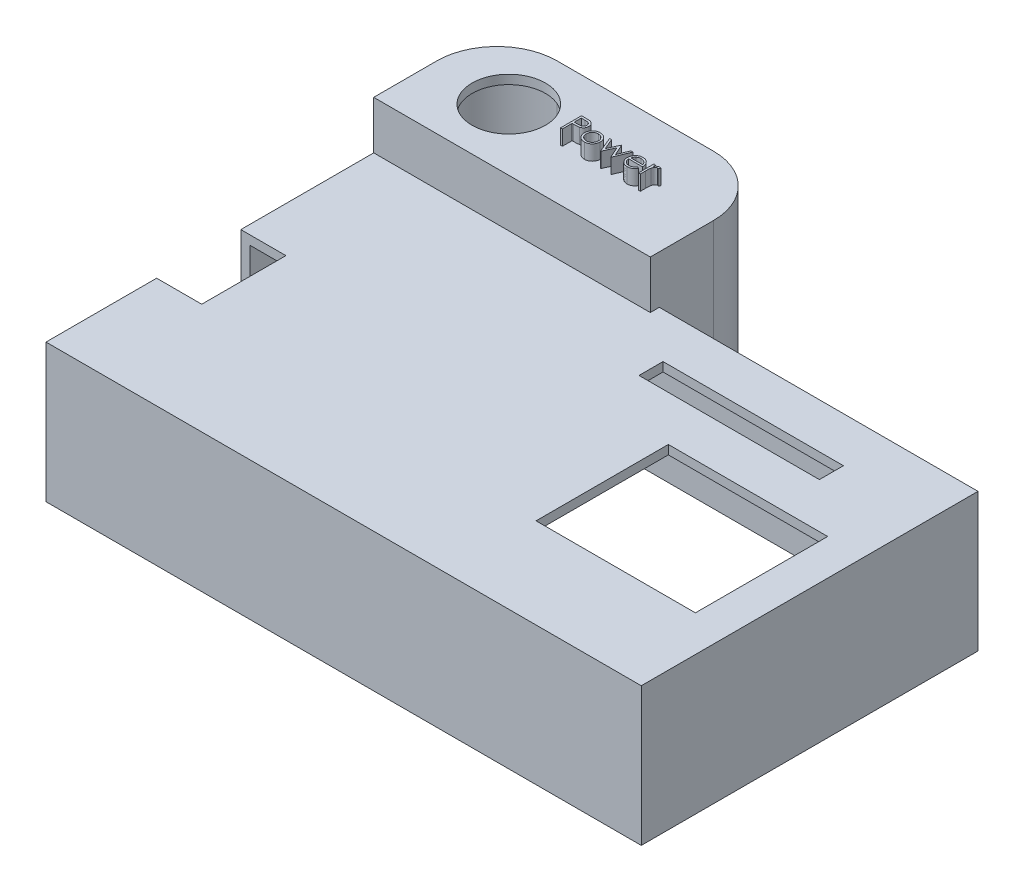
from build123d import *

# Parameters (mm, degrees)
SKETCH1_W           = 99
SKETCH1_H           = 56
BOSS_EXTRUDE1_DEPTH = 23
SKETCH3_W           = 96
SKETCH3_H           = 53
CUT_EXTRUDE1_DEPTH  = 21.5
SKETCH4_W           = 7.5
SKETCH4_H           = 14
CUT_EXTRUDE4_DEPTH  = 11
BOSS_EXTRUDE5_DEPTH = 31
CUT_EXTRUDE8_DEPTH  = 29.5
SKETCH16_W          = 37.752580564
SKETCH16_H          = 16
CUT_EXTRUDE10_DEPTH = 2
SKETCH17_R          = 6.1
CUT_EXTRUDE11_DEPTH = 2
BOSS_EXTRUDE6_DEPTH = 2.5
SKETCH19_W          = 26.5
SKETCH19_H          = 22
CUT_EXTRUDE12_DEPTH = 2
SKETCH20_W          = 30
SKETCH20_H          = 4
CUT_EXTRUDE13_DEPTH = 2


with BuildPart() as part:
    # Sketch1 → Boss-Extrude1 (new body)
    with BuildSketch(Plane(origin=(0, 0, 0), x_dir=(1, 0, 0), z_dir=(0, 1, 0))):
        Rectangle(SKETCH1_W, SKETCH1_H)
    extrude(amount=BOSS_EXTRUDE1_DEPTH)

    # Sketch3 → Cut-Extrude1 (cut)
    with BuildSketch(Plane.XZ):
        Rectangle(SKETCH3_W, SKETCH3_H)
    extrude(amount=-CUT_EXTRUDE1_DEPTH, mode=Mode.SUBTRACT)

    # Sketch4 → Cut-Extrude4 (cut)
    with BuildSketch(Plane(origin=(0, 23, 0), x_dir=(1, 0, 0), z_dir=(0, 1, 0))):
        with Locations((-45.75, -2.6)):
            Rectangle(SKETCH4_W, SKETCH4_H)
    extrude(amount=-CUT_EXTRUDE4_DEPTH, mode=Mode.SUBTRACT)

    # Sketch9 → Boss-Extrude5 (add)
    with BuildSketch(Plane.XZ):
        with BuildLine():
            Line((-3.5, -26.5), (-49.5, -26.5))
            Line((-49.5, -26.5), (-49.5, -37))
            ThreePointArc((-49.5, -37), (-46.571067812, -44.071067812), (-39.5, -47))
            Line((-39.5, -47), (-13.5, -47))
            ThreePointArc((-13.5, -47), (-6.428932188, -44.071067812), (-3.5, -37))
            Line((-3.5, -37), (-3.5, -26.5))
        make_face()
    extrude(amount=-BOSS_EXTRUDE5_DEPTH)

    # Sketch14 → Cut-Extrude8 (cut)
    with BuildSketch(Plane(origin=(0, 0, 0), x_dir=(-1, 0, 0), z_dir=(0, -1, 0))):
        with BuildLine():
            Line((5, 28), (48, 28))
            Line((48, 28), (48, 35.5))
            ThreePointArc((48, 35.5), (45.071067812, 42.571067812), (38, 45.5))
            Line((38, 45.5), (15, 45.5))
            ThreePointArc((15, 45.5), (7.928932188, 42.571067812), (5, 35.5))
            Line((5, 35.5), (5, 28))
        make_face()
    extrude(amount=-CUT_EXTRUDE8_DEPTH, mode=Mode.SUBTRACT)

    # Sketch16 → Cut-Extrude10 (cut)
    with BuildSketch(Plane.XY.offset(-26.5)):
        with Locations((-27.111178413, 12)):
            Rectangle(SKETCH16_W, SKETCH16_H)
    extrude(amount=-CUT_EXTRUDE10_DEPTH, mode=Mode.SUBTRACT)

    # Sketch17 → Cut-Extrude11 (cut)
    with BuildSketch(Plane(origin=(0, 29.5, 0), x_dir=(-1, 0, 0), z_dir=(0, -1, 0))):
        with Locations(Location((37.281553398, 36.75, 0), (0, 0, 90))):
            Circle(SKETCH17_R)
    extrude(amount=-CUT_EXTRUDE11_DEPTH, mode=Mode.SUBTRACT)

    # Sketch18 → Boss-Extrude6 (add)
    # profile 1 of 5: a face of its own
    with BuildSketch(Plane(origin=(0, 31, 0), x_dir=(1, 0, 0), z_dir=(0, 1, 0))):
        with BuildLine():
            Line((-27.068619083, 38.631067961), (-26.382220846, 38.631067961))
            add(Edge.make_bspline(
                [(-26.382220846, 38.631067961), (-26.33500994, 38.631016065), (-26.244551747, 38.630916629), (-26.114836691, 38.627901884), (-25.99702696, 38.623875192), (-25.891376579, 38.618293298), (-25.797560481, 38.611696708), (-25.716003181, 38.602444669), (-25.646063625, 38.592784373), (-25.604157175, 38.582962967), (-25.585045365, 38.578483827)],
                knots=[0, 0, 0, 0, 1.415646017, 2.712440637, 3.8905458, 4.950247383, 5.884950622, 6.709939814, 7.411656543, 8, 8, 8, 8], degree=3))
            add(Edge.make_bspline(
                [(-25.585045365, 38.578483827), (-25.560851831, 38.571861877), (-25.513034854, 38.558774015), (-25.444133811, 38.532560292), (-25.378579966, 38.501478126), (-25.316148407, 38.466054187), (-25.257606324, 38.424768622), (-25.202080283, 38.379295005), (-25.150060303, 38.328583436), (-25.101838911, 38.273202696), (-25.057554113, 38.214082486), (-25.019424431, 38.150340256), (-24.987497204, 38.083048953), (-24.960113932, 38.012255382), (-24.940405478, 37.937365058), (-24.925558578, 37.858898346), (-24.91613495, 37.776863656), (-24.915232389, 37.720803788), (-24.914772929, 37.692265878)],
                knots=[0, 0, 0, 0, 0.999701418, 1.975846123, 2.934577507, 3.890451536, 4.834027766, 5.787354733, 6.749476667, 7.726910423, 8.712836071, 9.690891519, 10.682875813, 11.679750201, 12.712814741, 13.765529915, 14.8625177, 16, 16, 16, 16], degree=3))
            add(Edge.make_bspline(
                [(-24.914772929, 37.692265878), (-24.915194354, 37.663488101), (-24.9160189, 37.607182437), (-24.925915185, 37.524809649), (-24.939245377, 37.446091259), (-24.959742429, 37.371201808), (-24.986588102, 37.300586038), (-25.018080155, 37.233164806), (-25.056063686, 37.170085134), (-25.099708515, 37.111118016), (-25.14826011, 37.056208104), (-25.201513048, 37.00575331), (-25.25925234, 36.960048971), (-25.321294488, 36.918992627), (-25.388244337, 36.883536348), (-25.459086491, 36.851779043), (-25.534436707, 36.825107982), (-25.586579221, 36.811077921), (-25.613090237, 36.803944564)],
                knots=[0, 0, 0, 0, 1.121902311, 2.195077645, 3.232258892, 4.234102512, 5.217864754, 6.176164875, 7.132989551, 8.084763148, 9.034132444, 9.988522005, 10.94243251, 11.903244335, 12.886203696, 13.894208494, 14.929344452, 16, 16, 16, 16], degree=3))
            add(Edge.make_bspline(
                [(-25.613090237, 36.803944564), (-25.635017571, 36.799281583), (-25.683072598, 36.789062388), (-25.762215321, 36.777653932), (-25.854360706, 36.767916331), (-25.959382986, 36.760615193), (-26.077187891, 36.754364825), (-26.207839149, 36.749396731), (-26.351593226, 36.746666877), (-26.45186447, 36.746526084), (-26.504216038, 36.746452577)],
                knots=[0, 0, 0, 0, 0.601384939, 1.31797006, 2.144135048, 3.087295005, 4.142315834, 5.309527816, 6.595305764, 8, 8, 8, 8], degree=3))
            Line((-26.504216038, 36.746452577), (-26.754516519, 36.746452577))
            Line((-26.754516519, 36.746452577), (-26.754516519, 35.131067961))
            Line((-26.754516519, 35.131067961), (-27.068619083, 35.131067961))
            Line((-27.068619083, 35.131067961), (-27.068619083, 38.631067961))
        make_face()
        with BuildLine():
            Line((-26.754516519, 38.272093602), (-26.754516519, 37.105426936))
            Line((-26.754516519, 37.105426936), (-26.14173607, 37.097714596))
            add(Edge.make_bspline(
                [(-26.14173607, 37.097714596), (-26.111816145, 37.097699132), (-26.054056345, 37.09766928), (-25.970620121, 37.101654504), (-25.893210834, 37.106255036), (-25.822066259, 37.11299096), (-25.757154324, 37.122512217), (-25.698366795, 37.132123955), (-25.646159512, 37.146029318), (-25.585060311, 37.164752387), (-25.516976963, 37.196685002), (-25.442909415, 37.243034893), (-25.380138828, 37.302115601), (-25.325820532, 37.368543432), (-25.282714654, 37.442442561), (-25.251158661, 37.521511498), (-25.232617504, 37.604939348), (-25.23013131, 37.662027487), (-25.228875493, 37.690863634)],
                knots=[0, 0, 0, 0, 1.160613943, 2.240541288, 3.23993089, 4.169200891, 5.011653406, 5.7853311, 6.478053781, 7.106038997, 8.262395093, 9.384106736, 10.481365981, 11.59014053, 12.70357646, 13.786202915, 14.881775077, 16, 16, 16, 16], degree=3))
            add(Edge.make_bspline(
                [(-25.228875493, 37.690863634), (-25.23013814, 37.719002148), (-25.232648125, 37.77493803), (-25.251303988, 37.85691679), (-25.282653302, 37.935152495), (-25.326109896, 38.00812558), (-25.378851026, 38.074314384), (-25.44015037, 38.131811511), (-25.509863631, 38.178033214), (-25.574711862, 38.207866496), (-25.632313048, 38.226081771), (-25.682345008, 38.238826611), (-25.738835682, 38.249002218), (-25.801803462, 38.257241721), (-25.870760296, 38.264295182), (-25.946298611, 38.269081159), (-26.028132254, 38.271882615), (-26.084942825, 38.27202157), (-26.11439232, 38.272093602)],
                knots=[0, 0, 0, 0, 1.120700087, 2.227813068, 3.331159281, 4.466773991, 5.599788987, 6.693661531, 7.80175334, 8.91857717, 9.525282508, 10.207424825, 10.974604443, 11.810962634, 12.737642355, 13.736264703, 14.826523623, 16, 16, 16, 16], degree=3))
            Line((-26.11439232, 38.272093602), (-26.754516519, 38.272093602))
        make_face(mode=Mode.SUBTRACT)
    # profile 2 of 5: a face of its own
    with BuildSketch(Plane(origin=(0, 31, 0), x_dir=(1, 0, 0), z_dir=(0, 1, 0))):
        with BuildLine():
            add(Edge.make_bspline(
                [(-23.051191199, 37.733632064), (-23.003199926, 37.732610173), (-22.909100768, 37.730606494), (-22.771292882, 37.709191528), (-22.639747746, 37.676444164), (-22.513961554, 37.631172602), (-22.395545259, 37.570490651), (-22.282774015, 37.49808136), (-22.175957006, 37.412298766), (-22.111933976, 37.345940698), (-22.079436391, 37.312257865)],
                knots=[0, 0, 0, 0, 1.054011418, 2.066658804, 3.057071809, 4.030435133, 4.997543892, 5.974964718, 6.972108034, 8, 8, 8, 8], degree=3))
            add(Edge.make_bspline(
                [(-22.079436391, 37.312257865), (-22.051454437, 37.280043879), (-21.996032057, 37.216239337), (-21.924966338, 37.112783724), (-21.863744778, 37.005643623), (-21.814681817, 36.893396297), (-21.775996793, 36.777021626), (-21.748531097, 36.656119614), (-21.732194162, 36.530957267), (-21.729991195, 36.445953429), (-21.728875493, 36.402902897)],
                knots=[0, 0, 0, 0, 1.025258237, 2.030674902, 3.01204498, 3.988269485, 4.97094183, 5.956517959, 6.965070386, 8, 8, 8, 8], degree=3))
            add(Edge.make_bspline(
                [(-21.728875493, 36.402902897), (-21.729856831, 36.359602839), (-21.731795999, 36.274039906), (-21.750139615, 36.14802054), (-21.778670701, 36.025825718), (-21.81950254, 35.907967024), (-21.871860649, 35.794084196), (-21.935751336, 35.684674647), (-22.011622953, 35.579522514), (-22.09762695, 35.479520676), (-22.192678826, 35.387354461), (-22.295794975, 35.307026191), (-22.404949008, 35.238204667), (-22.521592362, 35.182768251), (-22.644659849, 35.139058551), (-22.774416917, 35.108358535), (-22.910661987, 35.089796851), (-23.003689208, 35.087413278), (-23.051191199, 35.086196166)],
                knots=[0, 0, 0, 0, 0.998656419, 1.973391657, 2.932242238, 3.890759089, 4.846373663, 5.82037756, 6.809684879, 7.83454468, 8.860553229, 9.859544525, 10.845671541, 11.83227036, 12.833544569, 13.85385346, 14.904124723, 16, 16, 16, 16], degree=3))
            add(Edge.make_bspline(
                [(-23.051191199, 35.086196166), (-23.098925918, 35.087417363), (-23.192416778, 35.089809137), (-23.32914276, 35.10828642), (-23.459132379, 35.139044402), (-23.582360977, 35.182911895), (-23.699505824, 35.238206439), (-23.809292321, 35.306818128), (-23.912492237, 35.387378284), (-24.007564221, 35.479514221), (-24.093562826, 35.579524177), (-24.169435835, 35.684674215), (-24.233326161, 35.794084309), (-24.285684365, 35.907966994), (-24.326516178, 36.025825726), (-24.35504727, 36.148020538), (-24.373390885, 36.274039907), (-24.375330053, 36.35960284), (-24.376311391, 36.402902897)],
                knots=[0, 0, 0, 0, 1.099876186, 2.154163076, 3.173186993, 4.173200201, 5.163417411, 6.152872554, 7.150605724, 8.17532212, 9.198891216, 10.186952605, 11.159729845, 12.11414092, 13.071450619, 14.029093627, 15.002601286, 16, 16, 16, 16], degree=3))
            add(Edge.make_bspline(
                [(-24.376311391, 36.402902897), (-24.375188081, 36.445719443), (-24.372964119, 36.530488845), (-24.35664361, 36.655415906), (-24.329285054, 36.776113295), (-24.290553657, 36.892038771), (-24.241038466, 37.003794207), (-24.180677178, 37.111199038), (-24.108886546, 37.214186839), (-24.053684594, 37.277908919), (-24.025750493, 37.3101545)],
                knots=[0, 0, 0, 0, 1.031353054, 2.041901799, 3.029428768, 4.008703097, 4.981709435, 5.96992636, 6.972712378, 8, 8, 8, 8], degree=3))
            add(Edge.make_bspline(
                [(-24.025750493, 37.3101545), (-23.993301902, 37.344129439), (-23.929486039, 37.410947135), (-23.822137311, 37.496479659), (-23.70964349, 37.570395733), (-23.589918564, 37.629871948), (-23.464235706, 37.676710466), (-23.332016463, 37.709275981), (-23.193740948, 37.730529336), (-23.099181327, 37.732587514), (-23.051191199, 37.733632064)],
                knots=[0, 0, 0, 0, 1.027980169, 2.021703884, 2.998553061, 3.971491411, 4.943284454, 5.930300938, 6.949603206, 8, 8, 8, 8], degree=3))
        make_face()
        with BuildLine():
            add(Edge.make_bspline(
                [(-23.052593442, 37.4195295), (-23.086531053, 37.418564908), (-23.153530182, 37.416660625), (-23.252149767, 37.402176721), (-23.347089921, 37.379229217), (-23.438530765, 37.34662516), (-23.526163937, 37.304526261), (-23.61007334, 37.252817901), (-23.69050578, 37.192184945), (-23.765887843, 37.122722273), (-23.835070155, 37.046843279), (-23.895548132, 36.96599492), (-23.946973238, 36.881488573), (-23.989813397, 36.793236362), (-24.021720585, 36.700343948), (-24.044893608, 36.603863317), (-24.059363848, 36.503597901), (-24.061250227, 36.435436882), (-24.062208827, 36.400799532)],
                knots=[0, 0, 0, 0, 1.021534396, 2.016698045, 2.994645724, 3.958388632, 4.93408049, 5.916473867, 6.921342795, 7.962252576, 8.998418191, 10.008913653, 10.997312074, 11.973003931, 12.956656626, 13.948281152, 14.957379055, 16, 16, 16, 16], degree=3))
            add(Edge.make_bspline(
                [(-24.062208827, 36.400799532), (-24.060602003, 36.356047505), (-24.057412759, 36.267223099), (-24.031477522, 36.136411976), (-23.988091242, 36.010830124), (-23.929503963, 35.891213738), (-23.856097744, 35.78054146), (-23.769610677, 35.681869976), (-23.670970977, 35.596684164), (-23.561354477, 35.526003319), (-23.443000159, 35.469843563), (-23.317743838, 35.430044587), (-23.187103144, 35.404172895), (-23.097822413, 35.401601421), (-23.052593442, 35.40029873)],
                knots=[0, 0, 0, 0, 1.016792936, 2.018143844, 3.017858371, 4.030088057, 5.03801393, 6.028138512, 7.003788237, 7.991172063, 8.984598303, 9.972568034, 10.972917682, 12, 12, 12, 12], degree=3))
            add(Edge.make_bspline(
                [(-23.052593442, 35.40029873), (-23.007367073, 35.401609011), (-22.918091477, 35.404195468), (-22.7876323, 35.429914287), (-22.662718329, 35.470017948), (-22.544486941, 35.525940158), (-22.434920338, 35.596952573), (-22.335571216, 35.68138895), (-22.249822605, 35.780802801), (-22.176489, 35.89136033), (-22.116942258, 36.010644682), (-22.073759056, 36.136435154), (-22.04776147, 36.267217196), (-22.044580641, 36.356045527), (-22.042978058, 36.400799532)],
                knots=[0, 0, 0, 0, 1.02726834, 2.027799167, 3.010890988, 4.004497153, 4.992059811, 5.971914811, 6.958719428, 7.966827853, 8.981595046, 9.981490638, 10.983022906, 12, 12, 12, 12], degree=3))
            add(Edge.make_bspline(
                [(-22.042978058, 36.400799532), (-22.043936328, 36.435437089), (-22.045822057, 36.503598515), (-22.060297021, 36.603860969), (-22.083452561, 36.700352565), (-22.115424178, 36.793204569), (-22.158078192, 36.881717073), (-22.210494985, 36.9657468), (-22.27072601, 37.047123346), (-22.340743131, 37.122476987), (-22.416046509, 37.192212023), (-22.496511547, 37.252841413), (-22.580296526, 37.304299008), (-22.667675109, 37.346985249), (-22.759127676, 37.378932589), (-22.853934805, 37.402309221), (-22.952133615, 37.416599417), (-23.018892658, 37.418546559), (-23.052593442, 37.4195295)],
                knots=[0, 0, 0, 0, 1.042956736, 2.052379634, 3.044323526, 4.02829302, 5.004299113, 5.996692471, 7.007513377, 8.048758398, 9.090003419, 10.095195979, 11.07790575, 12.047570684, 13.018257071, 13.989683339, 14.985167495, 16, 16, 16, 16], degree=3))
        make_face(mode=Mode.SUBTRACT)
    # profile 3 of 5: a face of its own
    with BuildSketch(Plane(origin=(0, 31, 0), x_dir=(1, 0, 0), z_dir=(0, 1, 0))):
        Polygon((-21.459644724, 37.688760269), (-21.123106263, 37.688760269), (-20.36028575, 35.849016679), (-19.526651936, 37.688760269), (-19.472665558, 37.688760269), (-18.655157545, 35.849016679), (-17.886026936, 37.688760269), (-17.55579857, 37.688760269), (-18.625009308, 35.131067961), (-18.689512513, 35.131067961), (-19.507721647, 36.970811551), (-20.341355461, 35.131067961), (-20.398847449, 35.131067961), align=None)
    # profile 4 of 5: a face of its own
    with BuildSketch(Plane(origin=(0, 31, 0), x_dir=(1, 0, 0), z_dir=(0, 1, 0))):
        with BuildLine():
            Line((-15.052793763, 35.938760269), (-14.773747288, 35.792225814))
            add(Edge.make_bspline(
                [(-14.773747288, 35.792225814), (-14.795983884, 35.752782482), (-14.839247492, 35.67604138), (-14.91364824, 35.570609519), (-14.991640313, 35.475761803), (-15.076744281, 35.394032149), (-15.166413959, 35.322780764), (-15.261146614, 35.260442939), (-15.361435432, 35.207324419), (-15.467285157, 35.162571891), (-15.579584708, 35.128162397), (-15.698606224, 35.103858176), (-15.82457772, 35.088834907), (-15.9109239, 35.087089767), (-15.955137513, 35.086196166)],
                knots=[0, 0, 0, 0, 1.120438281, 2.179929193, 3.190490725, 4.156257408, 5.095198341, 6.022838206, 6.959905092, 7.901321166, 8.864066838, 9.862729781, 10.905609505, 12, 12, 12, 12], degree=3))
            add(Edge.make_bspline(
                [(-15.955137513, 35.086196166), (-16.00427949, 35.087343342), (-16.100141252, 35.089581148), (-16.239680999, 35.108873613), (-16.371060417, 35.140345971), (-16.494272121, 35.184311513), (-16.609014373, 35.241738837), (-16.715515228, 35.311698319), (-16.814334754, 35.393830574), (-16.902358963, 35.488847017), (-16.981602846, 35.590528974), (-17.051528666, 35.696484859), (-17.109986097, 35.806448083), (-17.157538707, 35.919718607), (-17.195943572, 36.035582501), (-17.222710276, 36.155093968), (-17.238140024, 36.277929553), (-17.240504469, 36.361026888), (-17.241696006, 36.402902897)],
                knots=[0, 0, 0, 0, 1.145258523, 2.234067595, 3.276747158, 4.290159414, 5.277019952, 6.260822364, 7.254936242, 8.264827045, 9.274100331, 10.257902744, 11.220704747, 12.172965371, 13.118907548, 14.062713208, 15.023725156, 16, 16, 16, 16], degree=3))
            add(Edge.make_bspline(
                [(-17.241696006, 36.402902897), (-17.240636865, 36.442197727), (-17.238537787, 36.520074892), (-17.225306999, 36.635340437), (-17.201858706, 36.747368889), (-17.169682382, 36.856253337), (-17.128131136, 36.961811471), (-17.077298917, 37.064107535), (-17.017106539, 37.163032675), (-16.970633865, 37.225435808), (-16.947224852, 37.256869243)],
                knots=[0, 0, 0, 0, 1.024358464, 2.0301432, 3.019427413, 4.004406732, 4.986367066, 5.972626655, 6.978780325, 8, 8, 8, 8], degree=3))
            add(Edge.make_bspline(
                [(-16.947224852, 37.256869243), (-16.91551717, 37.294738113), (-16.853106223, 37.369276264), (-16.747549868, 37.46721459), (-16.633249671, 37.549258365), (-16.511638045, 37.617265501), (-16.381301571, 37.668939148), (-16.24399228, 37.70744673), (-16.098146694, 37.729024741), (-15.998441473, 37.732072575), (-15.947425173, 37.733632064)],
                knots=[0, 0, 0, 0, 1.030682036, 2.02871468, 2.997146059, 3.962720338, 4.930598197, 5.918074684, 6.934738563, 8, 8, 8, 8], degree=3))
            add(Edge.make_bspline(
                [(-15.947425173, 37.733632064), (-15.894977568, 37.732278015), (-15.792087322, 37.72962168), (-15.642055201, 37.704995346), (-15.500094484, 37.665942792), (-15.36626198, 37.610789001), (-15.240544119, 37.539629449), (-15.123758069, 37.451487608), (-15.013906557, 37.349069521), (-14.949997978, 37.270306311), (-14.917477256, 37.230226615)],
                knots=[0, 0, 0, 0, 1.056321875, 2.072262726, 3.055038591, 4.01806755, 4.982017516, 5.957941055, 6.960871419, 8, 8, 8, 8], degree=3))
            add(Edge.make_bspline(
                [(-14.917477256, 37.230226615), (-14.895350318, 37.200023034), (-14.851243725, 37.139816915), (-14.795996625, 37.041645758), (-14.74803923, 36.938935163), (-14.709706269, 36.830024866), (-14.678666768, 36.716205286), (-14.656209949, 36.596662742), (-14.64304033, 36.47143283), (-14.640451633, 36.386106275), (-14.639131904, 36.342606423)],
                knots=[0, 0, 0, 0, 0.94817472, 1.890038105, 2.849395472, 3.817997239, 4.812318967, 5.836947057, 6.897266129, 8, 8, 8, 8], degree=3))
            Line((-14.639131904, 36.342606423), (-16.927593442, 36.342606423))
            add(Edge.make_bspline(
                [(-16.927593442, 36.342606423), (-16.926053836, 36.308905958), (-16.923026262, 36.242635355), (-16.908911119, 36.145664572), (-16.886662345, 36.053291229), (-16.855393282, 35.966208187), (-16.817526437, 35.88327806), (-16.77114072, 35.805116023), (-16.715801166, 35.732078093), (-16.654075467, 35.663510955), (-16.585368371, 35.602450194), (-16.513085624, 35.547798418), (-16.436192059, 35.501992821), (-16.355293976, 35.464812931), (-16.270522191, 35.435706615), (-16.181849996, 35.415838795), (-16.089451879, 35.402531688), (-16.026466145, 35.401052023), (-15.994400333, 35.40029873)],
                knots=[0, 0, 0, 0, 1.094153842, 2.151609401, 3.174256925, 4.172055639, 5.149267565, 6.128595816, 7.11444997, 8.118368179, 9.117203808, 10.09244225, 11.054858984, 12.015122123, 12.976791628, 13.957293641, 14.960065497, 16, 16, 16, 16], degree=3))
            add(Edge.make_bspline(
                [(-15.994400333, 35.40029873), (-15.963049186, 35.400906787), (-15.900842495, 35.402113288), (-15.808201637, 35.413845199), (-15.71706211, 35.432815475), (-15.627801127, 35.458705465), (-15.542230281, 35.490282317), (-15.462984731, 35.528385174), (-15.390104515, 35.570534921), (-15.321987548, 35.618744596), (-15.255916555, 35.677752783), (-15.190374069, 35.751388504), (-15.120097415, 35.838476032), (-15.076107823, 35.904021698), (-15.052793763, 35.938760269)],
                knots=[0, 0, 0, 0, 0.99110716, 1.966546729, 2.947904876, 3.932708344, 4.903319531, 5.828989031, 6.710028674, 7.56322171, 8.463672341, 9.504779593, 10.677557249, 12, 12, 12, 12], degree=3))
        make_face()
        with BuildLine():
            add(Edge.make_bspline(
                [(-14.953234468, 36.656708987), (-14.964731092, 36.698371861), (-14.986858394, 36.778559481), (-15.033094758, 36.889600372), (-15.085166299, 36.988288273), (-15.14678803, 37.073867906), (-15.216606756, 37.149871419), (-15.297251939, 37.216290004), (-15.387687832, 37.275707455), (-15.487446973, 37.325859954), (-15.593088758, 37.368549813), (-15.70369495, 37.397174929), (-15.816552738, 37.416784471), (-15.892887024, 37.41861058), (-15.931299372, 37.4195295)],
                knots=[0, 0, 0, 0, 1.154881502, 2.222775134, 3.210006277, 4.132804581, 5.035138423, 5.962687519, 6.919655026, 7.923214229, 8.944639381, 9.960483929, 10.97369054, 12, 12, 12, 12], degree=3))
            add(Edge.make_bspline(
                [(-15.931299372, 37.4195295), (-15.96264881, 37.418917828), (-16.024620059, 37.417708682), (-16.115921127, 37.406238553), (-16.203600826, 37.387278708), (-16.288306114, 37.361313751), (-16.368926982, 37.326705149), (-16.447121751, 37.286121922), (-16.520902147, 37.236580338), (-16.567043442, 37.198821483), (-16.590353859, 37.179745846)],
                knots=[0, 0, 0, 0, 1.04873581, 2.073130211, 3.073294108, 4.04793562, 5.032784715, 6.005352987, 6.992311501, 8, 8, 8, 8], degree=3))
            add(Edge.make_bspline(
                [(-16.590353859, 37.179745846), (-16.607047141, 37.16465153), (-16.640830275, 37.134104314), (-16.685970797, 37.081475108), (-16.729191269, 37.024723545), (-16.768524922, 36.961678421), (-16.804602508, 36.893057642), (-16.838362486, 36.819440007), (-16.868748898, 36.740266876), (-16.885845008, 36.685094437), (-16.894640718, 36.656708987)],
                knots=[0, 0, 0, 0, 0.879870761, 1.780643979, 2.707998968, 3.669668524, 4.684282772, 5.740141944, 6.837334558, 8, 8, 8, 8], degree=3))
            Line((-16.894640718, 36.656708987), (-14.953234468, 36.656708987))
        make_face(mode=Mode.SUBTRACT)
    # profile 5 of 5: a face of its own
    with BuildSketch(Plane(origin=(0, 31, 0), x_dir=(1, 0, 0), z_dir=(0, 1, 0))):
        with BuildLine():
            Line((-14.100670365, 37.688760269), (-13.786567801, 37.688760269))
            Line((-13.786567801, 37.688760269), (-13.786567801, 37.312257865))
            add(Edge.make_bspline(
                [(-13.786567801, 37.312257865), (-13.763379042, 37.347313693), (-13.719030721, 37.414357693), (-13.645317792, 37.503026994), (-13.569814461, 37.57644204), (-13.492159274, 37.634945559), (-13.411781174, 37.678758678), (-13.330444222, 37.710851713), (-13.246868752, 37.729829028), (-13.190706828, 37.732362687), (-13.162569404, 37.733632064)],
                knots=[0, 0, 0, 0, 1.2804753, 2.448899062, 3.506932113, 4.484331642, 5.4025378, 6.288909075, 7.142734305, 8, 8, 8, 8], degree=3))
            add(Edge.make_bspline(
                [(-13.162569404, 37.733632064), (-13.140743077, 37.732441537), (-13.095833992, 37.729991951), (-13.027851402, 37.712781127), (-12.95780795, 37.685303104), (-12.912665563, 37.659462881), (-12.889131904, 37.645991839)],
                knots=[0, 0, 0, 0, 0.901110191, 1.854092781, 2.881294221, 4, 4, 4, 4], degree=3))
            Line((-12.889131904, 37.645991839), (-13.061607865, 37.373956583))
            add(Edge.make_bspline(
                [(-13.061607865, 37.373956583), (-13.076716886, 37.380696849), (-13.105396701, 37.393491164), (-13.147351267, 37.408633175), (-13.186032604, 37.41754909), (-13.210676162, 37.418899808), (-13.222164756, 37.4195295)],
                knots=[0, 0, 0, 0, 1.180555205, 2.24091978, 3.179933427, 4, 4, 4, 4], degree=3))
            add(Edge.make_bspline(
                [(-13.222164756, 37.4195295), (-13.24737049, 37.417849462), (-13.29878288, 37.414422673), (-13.374267379, 37.387483865), (-13.447514585, 37.343958625), (-13.505686247, 37.295687513), (-13.5507285, 37.249139716), (-13.582868725, 37.208491313), (-13.612351472, 37.162912682), (-13.640521693, 37.113182998), (-13.666187987, 37.058453152), (-13.690142656, 36.999269938), (-13.711801519, 36.93556481), (-13.724151763, 36.891182289), (-13.730478058, 36.868447769)],
                knots=[0, 0, 0, 0, 1.125678352, 2.296057538, 3.5422874, 4.923748041, 5.663163013, 6.437101912, 7.23742474, 8.08941207, 8.991984279, 9.93940061, 10.944477711, 12, 12, 12, 12], degree=3))
            add(Edge.make_bspline(
                [(-13.730478058, 36.868447769), (-13.735210451, 36.848170595), (-13.745692343, 36.803258197), (-13.75588388, 36.727909672), (-13.765953398, 36.638886013), (-13.773050017, 36.53593942), (-13.779628059, 36.419326976), (-13.783338141, 36.288871031), (-13.786441282, 36.14443768), (-13.786524349, 36.043463326), (-13.786567801, 35.990643282)],
                knots=[0, 0, 0, 0, 0.566838948, 1.255505196, 2.06880316, 3.007127437, 4.065329342, 5.249902469, 6.561414163, 8, 8, 8, 8], degree=3))
            Line((-13.786567801, 35.990643282), (-13.786567801, 35.131067961))
            Line((-13.786567801, 35.131067961), (-14.100670365, 35.131067961))
            Line((-14.100670365, 35.131067961), (-14.100670365, 37.688760269))
        make_face()
    extrude(amount=BOSS_EXTRUDE6_DEPTH)

    # Sketch19 → Cut-Extrude12 (cut)
    with BuildSketch(Plane(origin=(0, 23, 0), x_dir=(1, 0, 0), z_dir=(0, 1, 0))):
        with Locations((30.25, -2)):
            Rectangle(SKETCH19_W, SKETCH19_H)
    extrude(amount=-CUT_EXTRUDE12_DEPTH, mode=Mode.SUBTRACT)

    # Sketch20 → Cut-Extrude13 (cut)
    with BuildSketch(Plane(origin=(0, 23, 0), x_dir=(1, 0, 0), z_dir=(0, 1, 0))):
        with Locations((19.618585298, 18.5)):
            Rectangle(SKETCH20_W, SKETCH20_H)
    extrude(amount=-CUT_EXTRUDE13_DEPTH, mode=Mode.SUBTRACT)


solid = part.part
